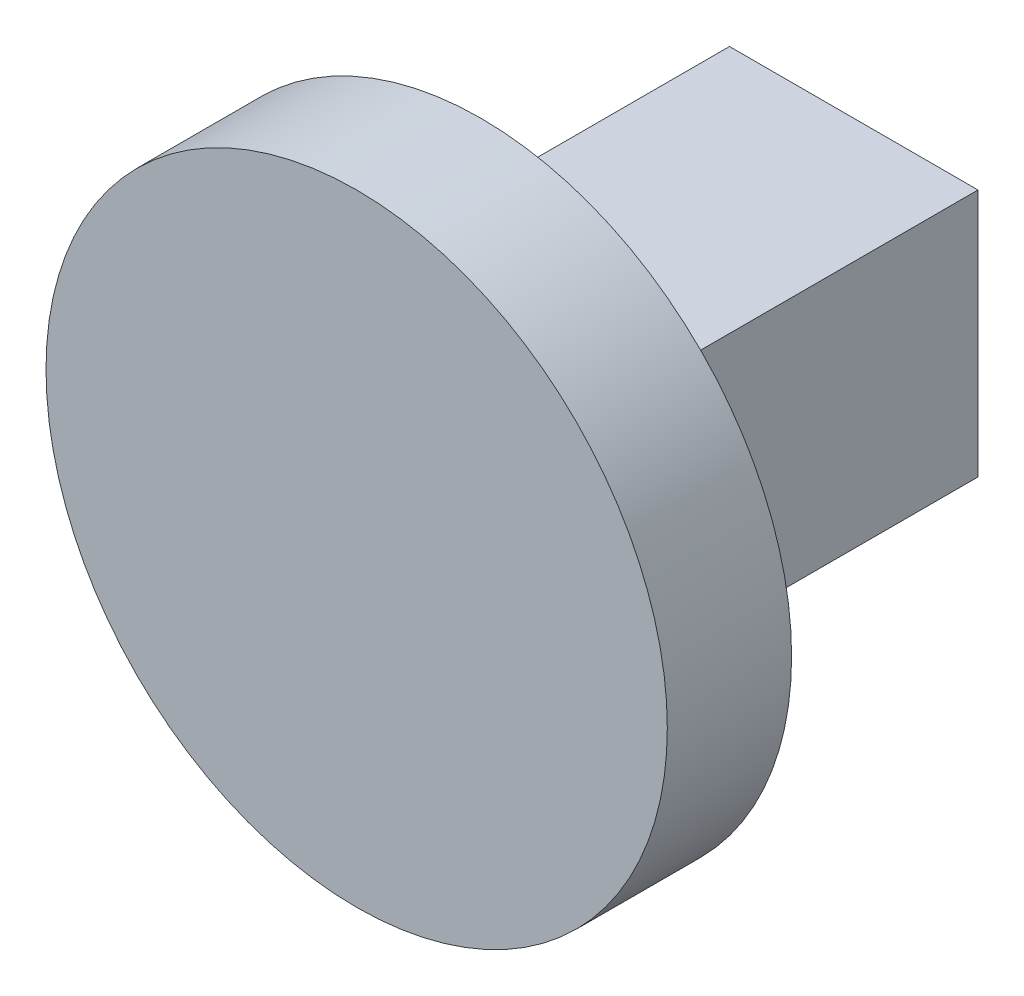
from build123d import *

# Parameters (mm, degrees)
CROQUIS1_W              = 10
CROQUIS1_H              = 10
SALIENTE_EXTRUIR1_DEPTH = 15
CROQUIS2_R              = 12.5
SALIENTE_EXTRUIR2_DEPTH = 5


with BuildPart() as part:
    # Croquis1 → Saliente-Extruir1 (new body)
    with BuildSketch(Plane.XY):
        Rectangle(CROQUIS1_W, CROQUIS1_H)
    extrude(amount=SALIENTE_EXTRUIR1_DEPTH)

    # Croquis2 → Saliente-Extruir2 (add)
    with BuildSketch(Plane.XY.offset(15)):
        Circle(CROQUIS2_R)
    extrude(amount=SALIENTE_EXTRUIR2_DEPTH)


solid = part.part
